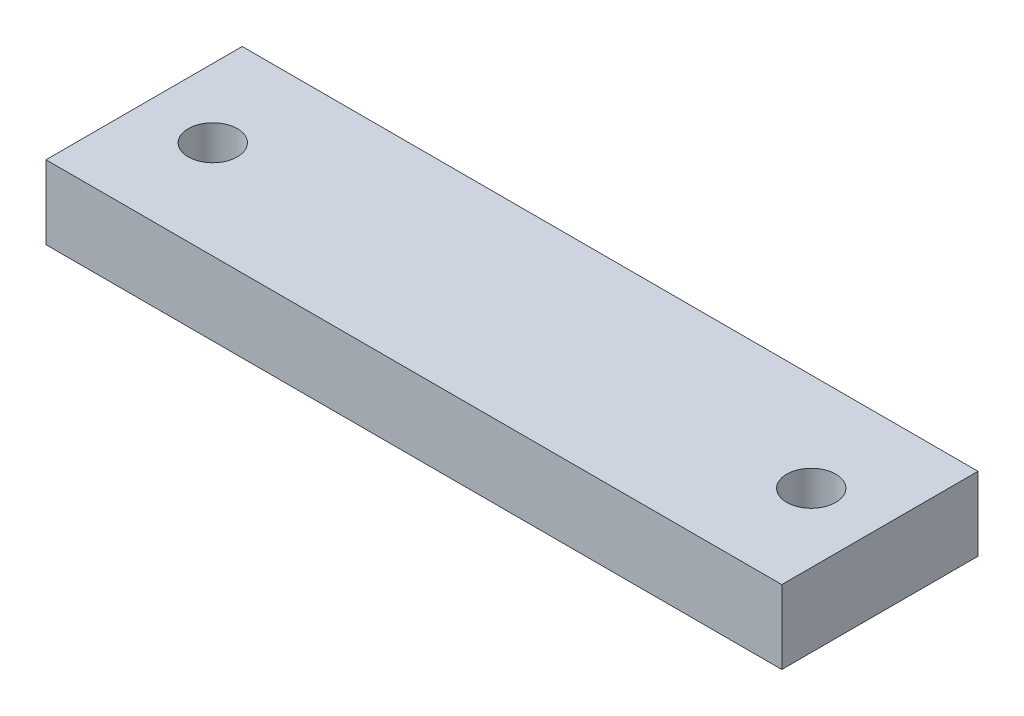
from build123d import *

# Parameters (mm, degrees)
SKETCH1_W           = 300
SKETCH1_H           = 80
BOSS_EXTRUDE1_DEPTH = 30
SKETCH2_R           = 10
CUT_EXTRUDE1_DEPTH  = 312.92947921


with BuildPart() as part:
    # Sketch1 → Boss-Extrude1 (new body)
    with BuildSketch(Plane(origin=(0, 0, 0), x_dir=(1, 0, 0), z_dir=(0, 1, 0))):
        with Locations((150, 40)):
            Rectangle(SKETCH1_W, SKETCH1_H)
    extrude(amount=BOSS_EXTRUDE1_DEPTH)

    # Sketch2 → Cut-Extrude1 (cut, through all)
    with BuildSketch(Plane(origin=(0, 30, 0), x_dir=(1, 0, 0), z_dir=(0, 1, 0))):
        with Locations(Location((28, 40, 0), (0, 0, 270))):
            Circle(SKETCH2_R)
        with Locations(Location((272, 40, 0), (0, 0, 270))):
            Circle(SKETCH2_R)
    extrude(amount=-CUT_EXTRUDE1_DEPTH, mode=Mode.SUBTRACT)


solid = part.part
